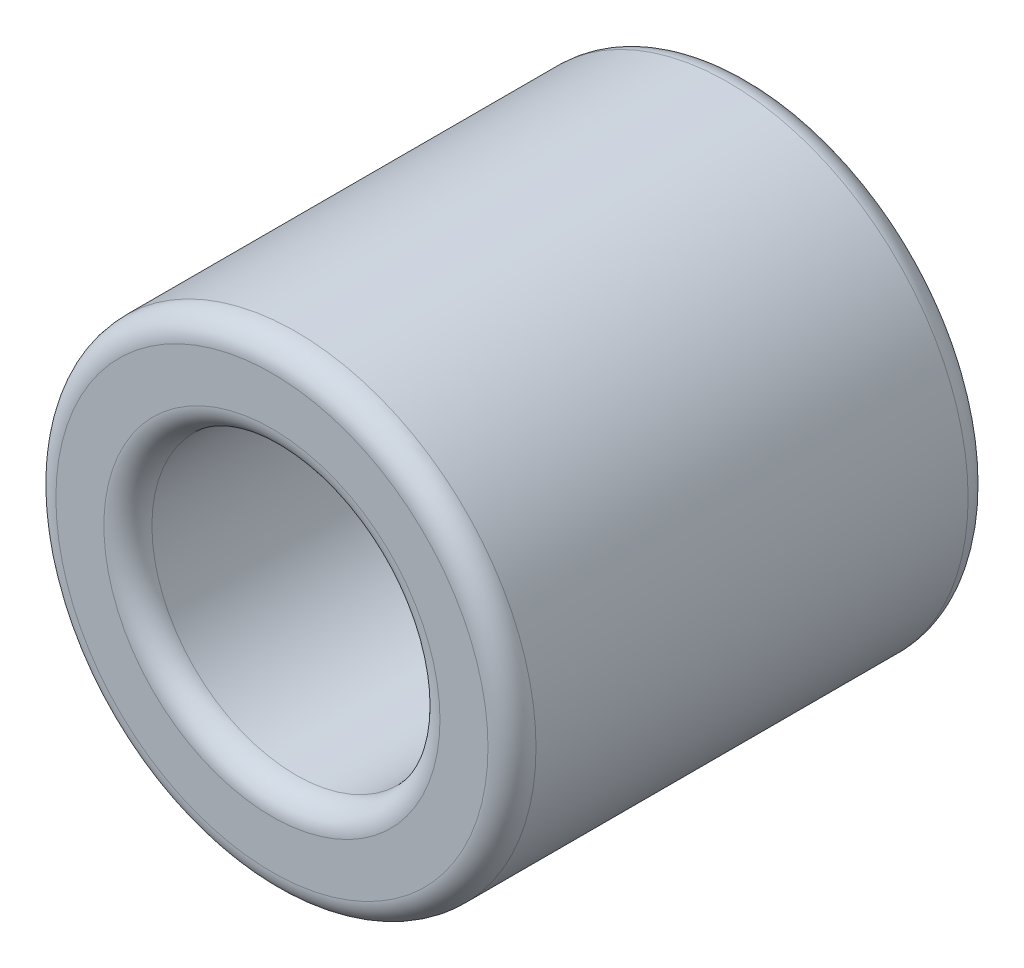
from build123d import *

# Parameters (mm, degrees)
SKETCH_1_R      = 5
SKETCH_1_R_2    = 3
EXTRUDE_1_DEPTH = 10
FILLET_1_R      = 0.5


with BuildPart() as part:
    # 草图1 → 凸台-拉伸1 (new body)
    with BuildSketch(Plane.XY):
        Circle(SKETCH_1_R)
        Circle(SKETCH_1_R_2, mode=Mode.SUBTRACT)
    extrude(amount=EXTRUDE_1_DEPTH)

    # 圆角1
    fillet_1_edges = [part.edges().sort_by_distance(p)[0] for p in [
        (-5, 0, 0),
        (-5, 0, 10),
        (-3, 0, 0),
        (-3, 0, 10),
    ]]
    fillet(fillet_1_edges, radius=FILLET_1_R)


solid = part.part
